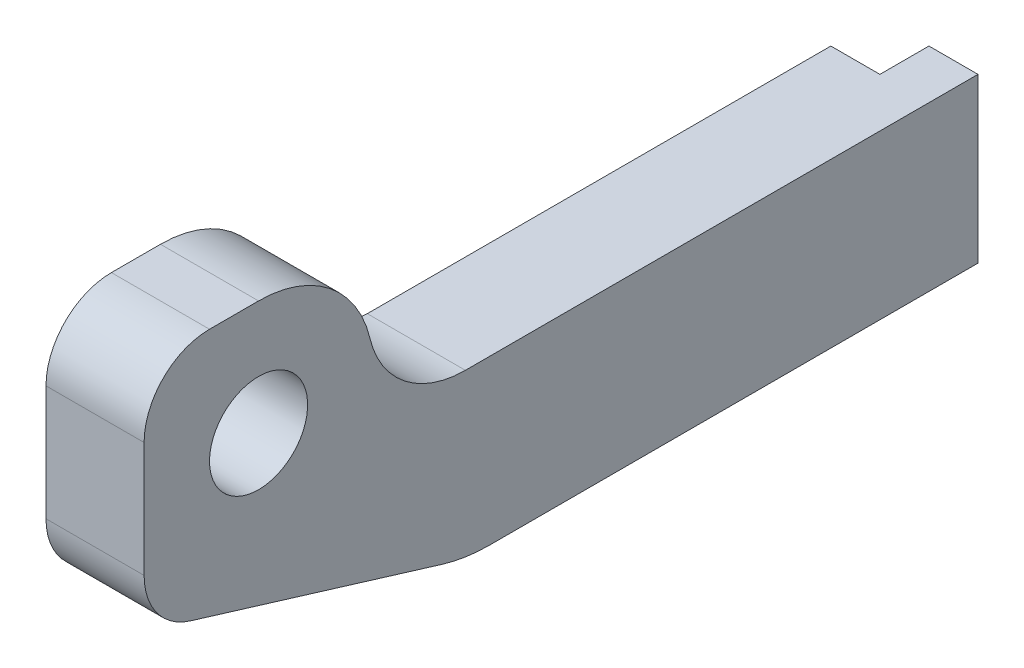
from build123d import *

# Parameters (mm, degrees)
TAB_EXTRUDE_DEPTH       = 5
SKETCH2_R               = 1.5
SCREWHOLE_EXTRUDE_DEPTH = 3
STRUCTURAL_FILLETS_R    = 5


with BuildPart() as part:
    # Sketch1 → Tab extrude (new body)
    with BuildSketch(Plane(origin=(0, 116.5, 0), x_dir=(1, 0, 0), z_dir=(0, 1, 0))):
        Polygon((-4, 23.815), (-2.5, 23.815), (-2.5, 25.315), (-1, 25.315), (-1, 9.63955532), (-4, 9.63955532), align=None)
    extrude(amount=-TAB_EXTRUDE_DEPTH)

    # Sketch2 → Screwhole extrude (add)
    with BuildSketch(Plane.ZY.offset(1)):
        with BuildLine():
            Line((-9.63955532, 111.5), (-1.230909725, 114.067641584))
            ThreePointArc((-1.230909725, 114.067641584), (-0.207489417, 114.790530608), (0.185, 115.980450657))
            Line((0.185, 115.980450657), (0.185, 119.5))
            ThreePointArc((0.185, 119.5), (-0.400786438, 120.914213562), (-1.815, 121.5))
            Line((-1.815, 121.5), (-3.315, 121.5))
            ThreePointArc((-3.315, 121.5), (-5.485607855, 120.745625892), (-6.720529788, 118.807692308))
            ThreePointArc((-6.720529788, 118.807692308), (-7.779034301, 117.146606378), (-9.63955532, 116.5))
            Line((-9.63955532, 116.5), (-9.63955532, 111.5))
        make_face()
        with Locations((-3.315, 118)):
            Circle(SKETCH2_R, mode=Mode.SUBTRACT)
    extrude(amount=SCREWHOLE_EXTRUDE_DEPTH)

    # Structural fillets
    structural_fillets_edges = [part.edges().sort_by_distance(p)[0] for p in [
        (-2.5, 111.5, -9.63955532),
    ]]
    fillet(structural_fillets_edges, radius=STRUCTURAL_FILLETS_R)


solid = part.part
